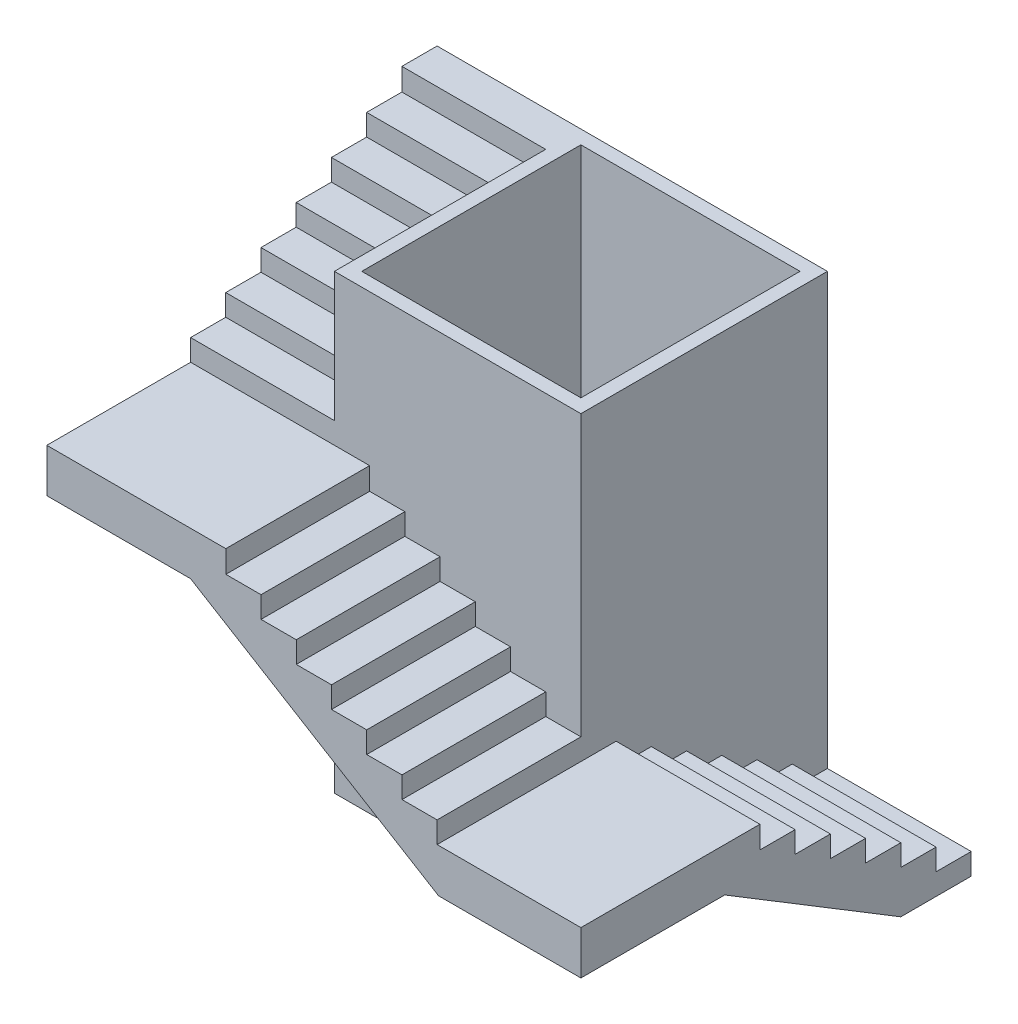
from build123d import *

# Parameters (mm, degrees)
SKETCH1_W           = 1828.8
SKETCH1_H           = 1752.6
SKETCH1_W_2         = 1625.6
SKETCH1_H_2         = 1625.6
SKETCH1_H_3         = 76.2
BOSS_EXTRUDE1_DEPTH = 3352.8
BOSS_EXTRUDE2_DEPTH = 1066.8
BOSS_EXTRUDE3_DEPTH = 1066.8
SKETCH5_W           = 1066.8
SKETCH5_H           = 1066.8
SKETCH5_W_2         = 522.078857143
BOSS_EXTRUDE5_DEPTH = 323.85
BOSS_EXTRUDE6_DEPTH = 1066.8
SKETCH7_W           = 1066.8
SKETCH7_H           = 1066.8
SKETCH7_H_2         = 522.078857143
BOSS_EXTRUDE7_DEPTH = 323.85
CUT_EXTRUDE1_DEPTH  = 1066.8
CUT_EXTRUDE2_DEPTH  = 1066.8


with BuildPart() as part:
    # Sketch1 → Boss-Extrude1 (new body)
    # profile 1 of 2: a face of its own
    with BuildSketch(Plane(origin=(0, 0, 0), x_dir=(1, 0, 0), z_dir=(0, 1, 0))):
        with Locations((0, -1943.1)):
            Rectangle(SKETCH1_W, SKETCH1_H)
        with Locations((0, -1981.2)):
            Rectangle(SKETCH1_W_2, SKETCH1_H_2, mode=Mode.SUBTRACT)
    # profile 2 of 2: a face of its own
    with BuildSketch(Plane(origin=(0, 0, 0), x_dir=(1, 0, 0), z_dir=(0, 1, 0))):
        with Locations((0, -2857.5)):
            Rectangle(SKETCH1_W, SKETCH1_H_3)
    extrude(amount=BOSS_EXTRUDE1_DEPTH)

    # Sketch3 → Boss-Extrude2 (add)
    with BuildSketch(Plane(origin=(914.4, 0, 0), x_dir=(0, 0, -1), z_dir=(1, 0, 0))):
        Polygon((-1588.878857143, 0), (-1066.8, 0), (-1066.8, 158.75), (-1327.512857143, 158.75), (-1327.512857143, 317.5), (-1588.878857143, 317.5), (-1588.878857143, 476.25), (-1850.244857143, 476.25), (-1850.244857143, 635), (-2111.610857143, 635), (-2111.610857143, 793.75), (-2372.976857143, 793.75), (-2372.976857143, 952.5), (-2634.342857143, 952.5), (-2634.342857143, 1117.6), (-2895.6, 1117.6), (-2895.6, 793.75), align=None)
    extrude(amount=BOSS_EXTRUDE2_DEPTH)

    # Sketch4 → Boss-Extrude3 (add)
    with BuildSketch(Plane.XY.offset(2895.6)):
        Polygon((392.321142857, 1117.6), (914.4, 1117.6), (914.4, 1276.35), (653.687142857, 1276.35), (653.687142857, 1435.1), (392.321142857, 1435.1), (392.321142857, 1593.85), (130.955142857, 1593.85), (130.955142857, 1752.6), (-130.410857143, 1752.6), (-130.410857143, 1911.35), (-391.776857143, 1911.35), (-391.776857143, 2070.1), (-653.142857143, 2070.1), (-653.142857143, 2235.2), (-914.4, 2235.2), (-914.4, 1911.35), align=None)
    extrude(amount=BOSS_EXTRUDE3_DEPTH)

    # Sketch5 → Boss-Extrude5 (add)
    with BuildSketch(Plane(origin=(0, 1117.6, 0), x_dir=(1, 0, 0), z_dir=(0, 1, 0))):
        with Locations((1447.8, -3429)):
            Rectangle(SKETCH5_W, SKETCH5_H)
        with Locations((653.360571429, -3429)):
            Rectangle(SKETCH5_W_2, SKETCH5_H)
    extrude(amount=-BOSS_EXTRUDE5_DEPTH)

    # Sketch6 → Boss-Extrude6 (add)
    with BuildSketch(Plane.ZY.offset(914.4)):
        Polygon((2373.521142857, 2235.2), (2895.6, 2235.2), (2895.6, 2393.95), (2634.887142857, 2393.95), (2634.887142857, 2552.7), (2373.521142857, 2552.7), (2373.521142857, 2711.45), (2112.155142857, 2711.45), (2112.155142857, 2870.2), (1850.789142857, 2870.2), (1850.789142857, 3028.95), (1589.423142857, 3028.95), (1589.423142857, 3187.7), (1328.057142857, 3187.7), (1328.057142857, 3352.8), (1066.8, 3352.8), (1066.8, 3028.95), align=None)
    extrude(amount=BOSS_EXTRUDE6_DEPTH)

    # Sketch7 → Boss-Extrude7 (add)
    with BuildSketch(Plane.XZ.offset(-2235.2)):
        with Locations((-1447.8, 3429)):
            Rectangle(SKETCH7_W, SKETCH7_H)
        with Locations((-1447.8, 2634.560571429)):
            Rectangle(SKETCH7_W, SKETCH7_H_2)
    extrude(amount=BOSS_EXTRUDE7_DEPTH)

    # Sketch8 → Cut-Extrude1 (cut)
    with BuildSketch(Plane.XY.offset(3962.4)):
        Polygon((925.463369143, 793.75), (392.321142857, 1117.6), (392.321142857, 793.75), align=None)
    extrude(amount=-CUT_EXTRUDE1_DEPTH, mode=Mode.SUBTRACT)

    # Sketch9 → Cut-Extrude2 (cut)
    with BuildSketch(Plane.ZY.offset(1981.2)):
        Polygon((2906.663369143, 1911.35), (2373.521142857, 2235.2), (2373.521142857, 1911.35), align=None)
    extrude(amount=-CUT_EXTRUDE2_DEPTH, mode=Mode.SUBTRACT)


solid = part.part
